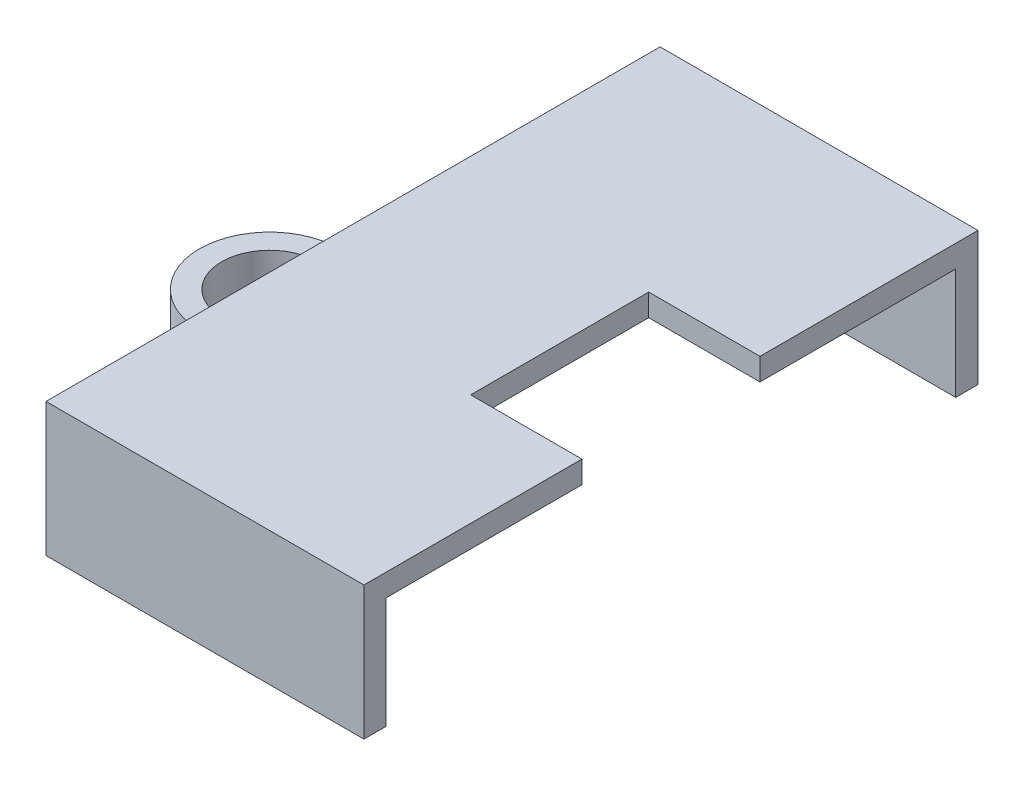
from build123d import *

# Parameters (mm, degrees)
BOSS_EXTRUDE1_START = 5
BOSS_EXTRUDE1_DEPTH = 1
SKETCH1_4_W         = 1
SKETCH1_4_H         = 4.3053
BOSS_EXTRUDE2_DEPTH = 5
BOSS_EXTRUDE3_DEPTH = 1.5875


with BuildPart() as part:
    # Sketch1 → Boss-Extrude1 (new body)
    with BuildSketch(Plane(origin=(0, 0, 0), x_dir=(1, 0, 0), z_dir=(0, 1, 0)).offset(BOSS_EXTRUDE1_START)):
        Polygon((13.035, -4), (13.035, 4), (18.035, 4), (18.035, 13.796348116), (3.75, 13.796348116), (3.75, -13.796348116), (18.035, -13.796348116), (18.035, -4), align=None)
    extrude(amount=BOSS_EXTRUDE1_DEPTH)

    # Sketch1<4> → Boss-Extrude2 (add)
    with BuildSketch(Plane(origin=(0, 0, 0), x_dir=(1, 0, 0), z_dir=(0, 1, 0))):
        with Locations((4.25, 0)):
            Rectangle(SKETCH1_4_W, SKETCH1_4_H)
        Polygon((3.75, 3.15265), (3.75, 2.15265), (4.75, 2.15265), (4.75, 12.796348116), (17.035, 12.796348116), (18.035, 12.796348116), (18.035, 13.796348116), (3.75, 13.796348116), align=None)
        Polygon((4.75, -2.15265), (3.75, -2.15265), (3.75, -3.15265), (3.75, -13.796348116), (18.035, -13.796348116), (18.035, -12.796348116), (17.035, -12.796348116), (4.75, -12.796348116), align=None)
    extrude(amount=BOSS_EXTRUDE2_DEPTH)

    # Sketch1<5> → Boss-Extrude3 (add)
    with BuildSketch(Plane(origin=(0, 0, 0), x_dir=(1, 0, 0), z_dir=(0, 1, 0))):
        with BuildLine():
            Line((2.303323685, 2.15265), (3.75, 2.15265))
            Line((3.75, 2.15265), (3.75, 3.15265))
            Line((3.75, 3.15265), (0, 3.15265))
            ThreePointArc((0, 3.15265), (1.255517821, 2.891863936), (2.303323685, 2.15265))
        make_face()
        with BuildLine():
            Line((3.75, -2.15265), (3.75, 2.15265))
            Line((3.75, 2.15265), (2.303323685, 2.15265))
            ThreePointArc((2.303323685, 2.15265), (2.932641765, 1.157071434), (3.15265, 0))
            ThreePointArc((3.15265, 0), (2.932641765, -1.157071434), (2.303323685, -2.15265))
            Line((2.303323685, -2.15265), (3.75, -2.15265))
        make_face()
        with BuildLine():
            Line((3.75, -3.15265), (3.75, -2.15265))
            Line((3.75, -2.15265), (2.303323685, -2.15265))
            ThreePointArc((2.303323685, -2.15265), (1.255517821, -2.891863936), (0, -3.15265))
            Line((0, -3.15265), (3.75, -3.15265))
        make_face()
        with BuildLine():
            ThreePointArc((3.15265, 0), (2.932641765, 1.157071434), (2.303323685, 2.15265))
            Line((2.303323685, 2.15265), (0, 2.15265))
            ThreePointArc((0, 2.15265), (1.522153413, 1.522153413), (2.15265, 0))
            ThreePointArc((2.15265, 0), (1.522153413, -1.522153413), (0, -2.15265))
            Line((0, -2.15265), (2.303323685, -2.15265))
            ThreePointArc((2.303323685, -2.15265), (2.932641765, -1.157071434), (3.15265, 0))
        make_face()
        with BuildLine():
            ThreePointArc((0, -2.15265), (-2.15265, 0), (0, 2.15265))
            Line((0, 2.15265), (0, 3.15265))
            ThreePointArc((0, 3.15265), (-3.15265, 0), (0, -3.15265))
            Line((0, -3.15265), (0, -2.15265))
        make_face()
        with BuildLine():
            Line((0, 2.15265), (2.303323685, 2.15265))
            ThreePointArc((2.303323685, 2.15265), (1.255517821, 2.891863936), (0, 3.15265))
            Line((0, 3.15265), (0, 2.15265))
        make_face()
        with BuildLine():
            ThreePointArc((0, -3.15265), (1.255517821, -2.891863936), (2.303323685, -2.15265))
            Line((2.303323685, -2.15265), (0, -2.15265))
            Line((0, -2.15265), (0, -3.15265))
        make_face()
    extrude(amount=BOSS_EXTRUDE3_DEPTH)


solid = part.part
